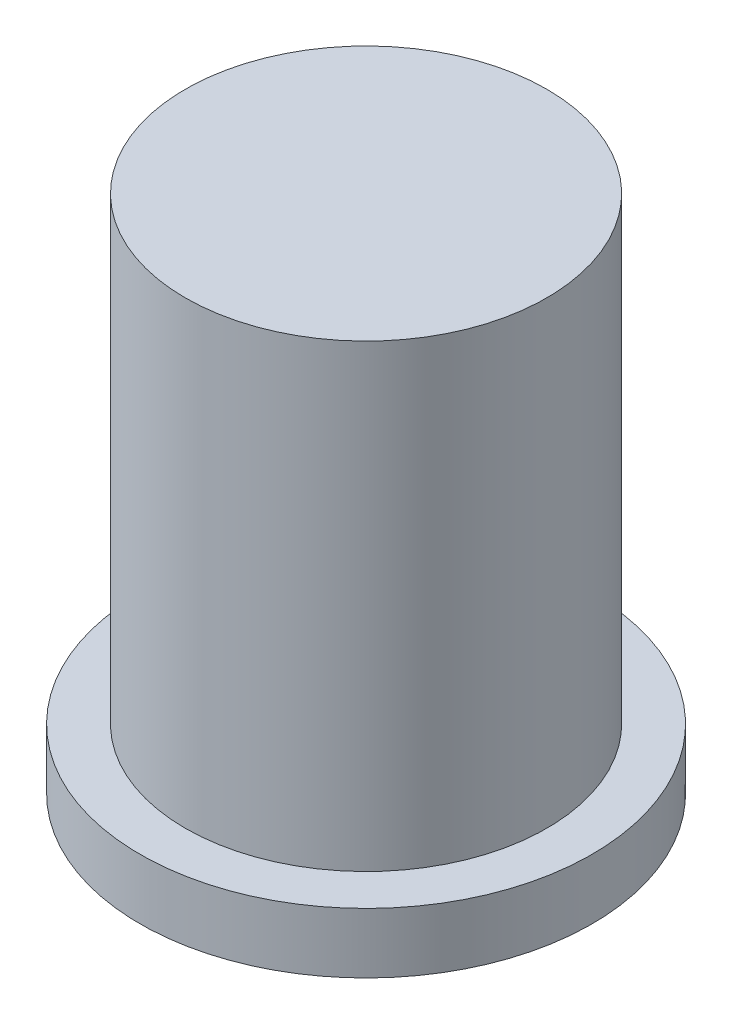
from build123d import *

# Parameters (mm, degrees)
SKETCH2_R           = 1.2
BOSS_EXTRUDE1_DEPTH = 3.45
SKETCH5_R           = 1.5
BOSS_EXTRUDE2_DEPTH = 0.4


with BuildPart() as part:
    # Sketch2 → Boss-Extrude1 (new body)
    with BuildSketch(Plane(origin=(0, 0, 0), x_dir=(1, 0, 0), z_dir=(0, 1, 0))):
        with Locations(Location((0, 0, 0), (0, 0, 90))):
            Circle(SKETCH2_R)
    extrude(amount=BOSS_EXTRUDE1_DEPTH)

    # Sketch5 → Boss-Extrude2 (add)
    with BuildSketch(Plane.XZ):
        with Locations(Location((0, 0, 0), (0, 0, 270))):
            Circle(SKETCH5_R)
    extrude(amount=-BOSS_EXTRUDE2_DEPTH)


solid = part.part
